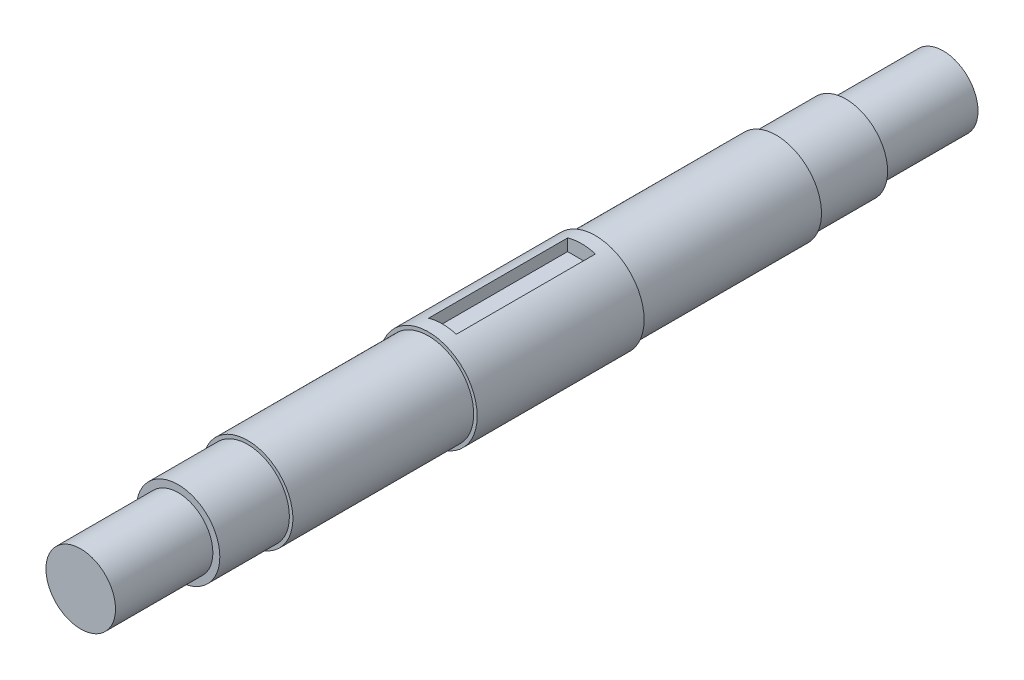
from build123d import *

# Parameters (mm, degrees)
SKETCH1_R           = 5
BOSS_EXTRUDE1_DEPTH = 14
SKETCH2_R           = 6
BOSS_EXTRUDE2_DEPTH = 10
SKETCH3_R           = 6.5
BOSS_EXTRUDE3_DEPTH = 26
SKETCH4_R           = 7
BOSS_EXTRUDE4_DEPTH = 12
SKETCH5_W           = 4
SKETCH5_H           = 20
CUT_EXTRUDE2_DEPTH  = 2


with BuildPart() as part:
    # Sketch1 → Boss-Extrude1 (new body)
    with BuildSketch(Plane(origin=(0, 0, 0), x_dir=(0, 1, 0), z_dir=(0, 0, 1))):
        with Locations(Location((0, 0, 0), (0, 0, 270))):
            Circle(SKETCH1_R)
    extrude(amount=BOSS_EXTRUDE1_DEPTH)

    # Sketch2 → Boss-Extrude2 (add)
    with BuildSketch(Plane.XY.offset(14)):
        Circle(SKETCH2_R)
    extrude(amount=BOSS_EXTRUDE2_DEPTH)

    # Sketch3 → Boss-Extrude3 (add)
    with BuildSketch(Plane.XY.offset(24)):
        with Locations(Location((0, 0, 0), (0, 0, 180))):
            Circle(SKETCH3_R)
    extrude(amount=BOSS_EXTRUDE3_DEPTH)

    # Sketch4 → Boss-Extrude4 (add)
    with BuildSketch(Plane.XY.offset(50)):
        Circle(SKETCH4_R)
    extrude(amount=BOSS_EXTRUDE4_DEPTH)

    # Mirror1: part across plane


with BuildPart() as part_1:
    add(part.part)
    add(part.part.mirror(Plane.XY.offset(62)))

    # Sketch5 → Cut-Extrude2 (cut)
    with BuildSketch(Plane(origin=(0, 7, 0), x_dir=(-1, 0, 0), z_dir=(0, 1, 0))):
        with Locations((0, 62)):
            Rectangle(SKETCH5_W, SKETCH5_H)
    extrude(amount=-CUT_EXTRUDE2_DEPTH, mode=Mode.SUBTRACT)


solid = part_1.part
